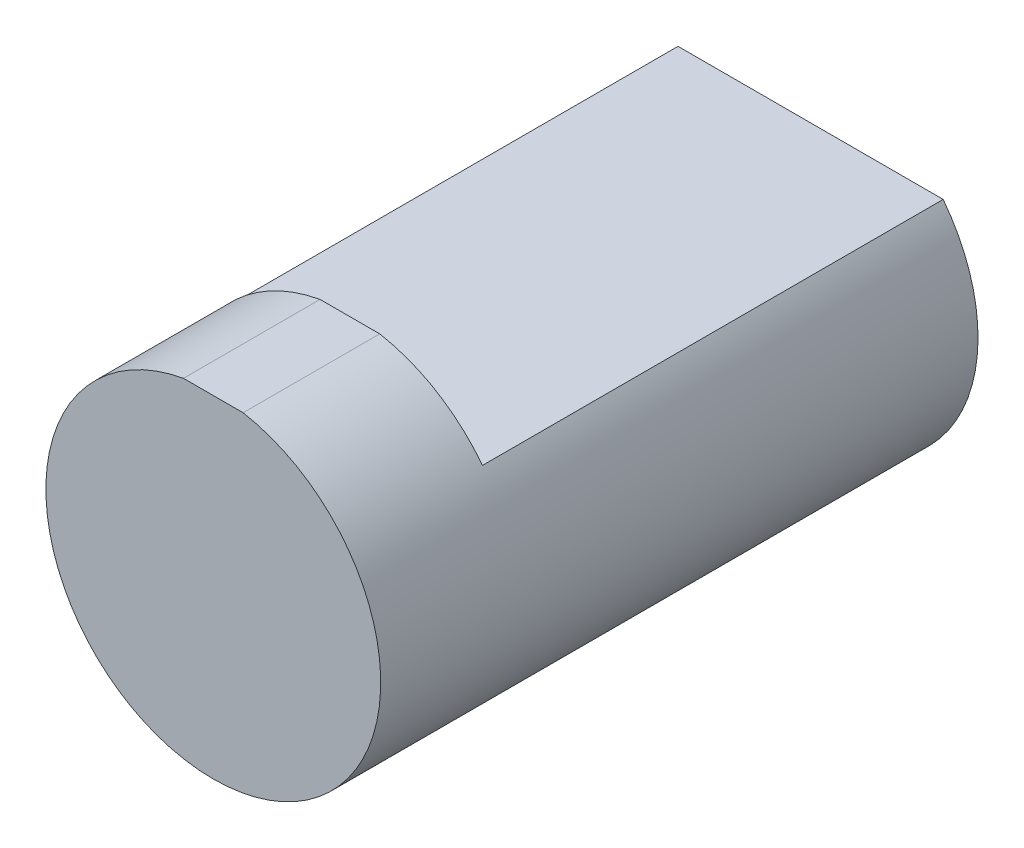
from build123d import *

# Parameters (mm, degrees)
SKETCH1_R               = 62.5
BOSS_EXTRUDE3_DEPTH     = 223
CUT_EXTRUDE1_DEPTH      = 240.878094039
CUT_EXTRUDE1_DEPTH_BACK = 172
SKETCH3_W               = 51
SKETCH3_H               = 1
CUT_EXTRUDE2_DEPTH      = 174


with BuildPart() as part:
    # Sketch1 → Boss-Extrude3 (new body)
    with BuildSketch(Plane.XY):
        with Locations(Location((0, 0, 0), (0, 0, 180))):
            Circle(SKETCH1_R)
    extrude(amount=BOSS_EXTRUDE3_DEPTH)

    # Sketch2 → Cut-Extrude1 (cut, two sides: drawn at the far end of the back side and taken through both)
    with BuildSketch(Plane(origin=(0, 0, 0), x_dir=(-1, 0, 0), z_dir=(0, 0, -1)).offset(-CUT_EXTRUDE1_DEPTH_BACK)):
        Polygon((-360.670689192, 38.157568057), (-49.5, 38.157568057), (49.5, 38.157568057), (360.670689192, 38.157568057), (360.670689192, 660.498946441), (-360.670689192, 660.498946441), align=None)
    extrude(amount=CUT_EXTRUDE1_DEPTH + CUT_EXTRUDE1_DEPTH_BACK, mode=Mode.SUBTRACT)

    # Sketch3 → Cut-Extrude2 (cut)
    with BuildSketch(Plane(origin=(-62.5, 0, 0), x_dir=(0, 0, -1), z_dir=(1, 0, 0))):
        with Locations((-197.5, 62)):
            Rectangle(SKETCH3_W, SKETCH3_H)
    extrude(amount=CUT_EXTRUDE2_DEPTH, mode=Mode.SUBTRACT)


solid = part.part
